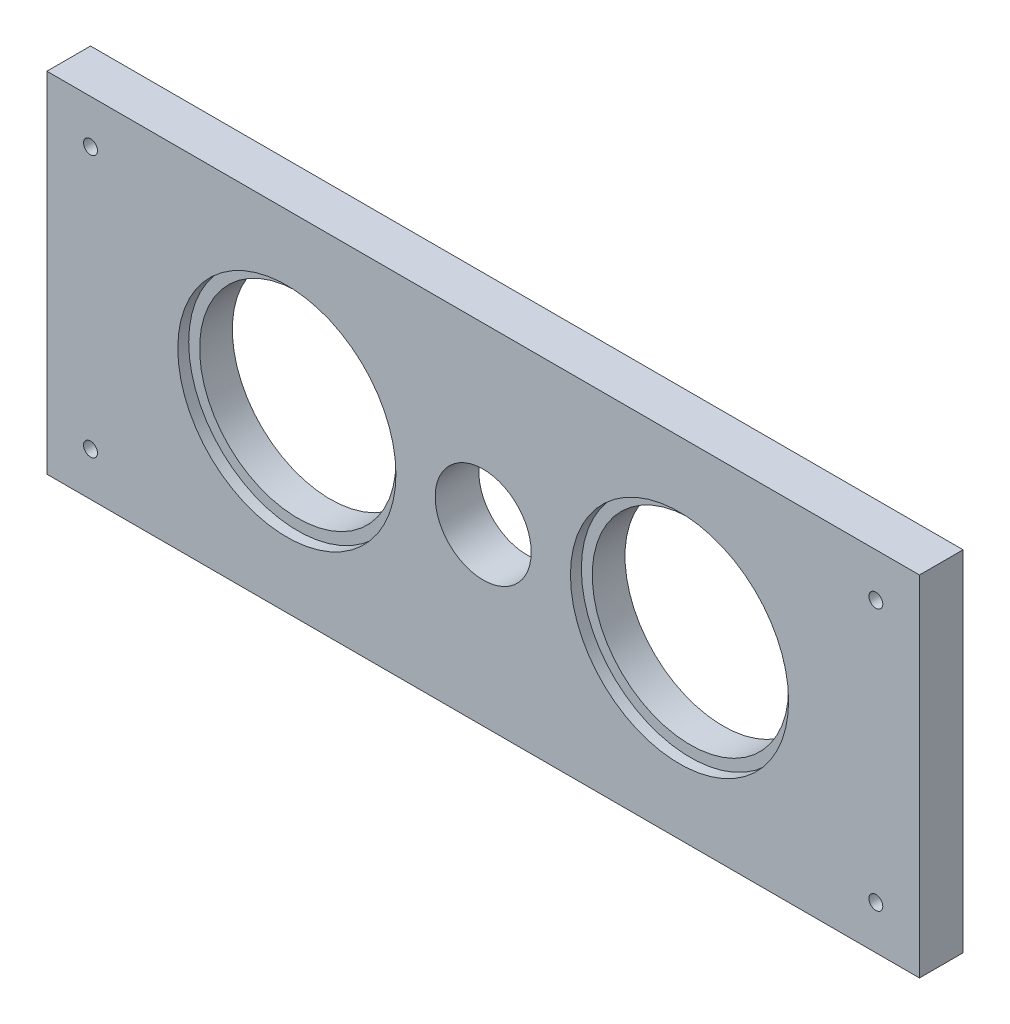
from build123d import *

# Parameters (mm, degrees)
SKETCH4_W          = 254
SKETCH4_H          = 101.6
BASE_EXTRUDE_DEPTH = 12.7
SKETCH5_R          = 28.575
SKETCH5_R_2        = 13.977315316
CUT_EXTRUDE1_DEPTH = 12.7
SKETCH6_R          = 31.75
CUT_EXTRUDE2_DEPTH = 3.175
SKETCH7_R          = 2.0193
CUT_EXTRUDE3_DEPTH = 25.4


with BuildPart() as part:
    # Sketch4 → Base-Extrude (new body)
    with BuildSketch(Plane.XY):
        Rectangle(SKETCH4_W, SKETCH4_H)
    extrude(amount=-BASE_EXTRUDE_DEPTH)

    # Sketch5 → Cut-Extrude1 (cut)
    with BuildSketch(Plane.XY):
        with Locations((-57.15, 0)):
            Circle(SKETCH5_R)
        with Locations((57.15, 0)):
            Circle(SKETCH5_R)
        Circle(SKETCH5_R_2)
    extrude(amount=-CUT_EXTRUDE1_DEPTH, mode=Mode.SUBTRACT)

    # Sketch6 → Cut-Extrude2 (cut)
    with BuildSketch(Plane.XY):
        with Locations((-57.15, 0)):
            Circle(SKETCH6_R)
        with Locations((57.15, 0)):
            Circle(SKETCH6_R)
    extrude(amount=-CUT_EXTRUDE2_DEPTH, mode=Mode.SUBTRACT)

    # Sketch7 → Cut-Extrude3 (cut)
    with BuildSketch(Plane.XY):
        with Locations((-114.3, -38.1)):
            Circle(SKETCH7_R)
        with Locations((-114.3, 38.1)):
            Circle(SKETCH7_R)
        with Locations((114.3, -38.1)):
            Circle(SKETCH7_R)
        with Locations((114.3, 38.1)):
            Circle(SKETCH7_R)
    extrude(amount=-CUT_EXTRUDE3_DEPTH, mode=Mode.SUBTRACT)


solid = part.part
